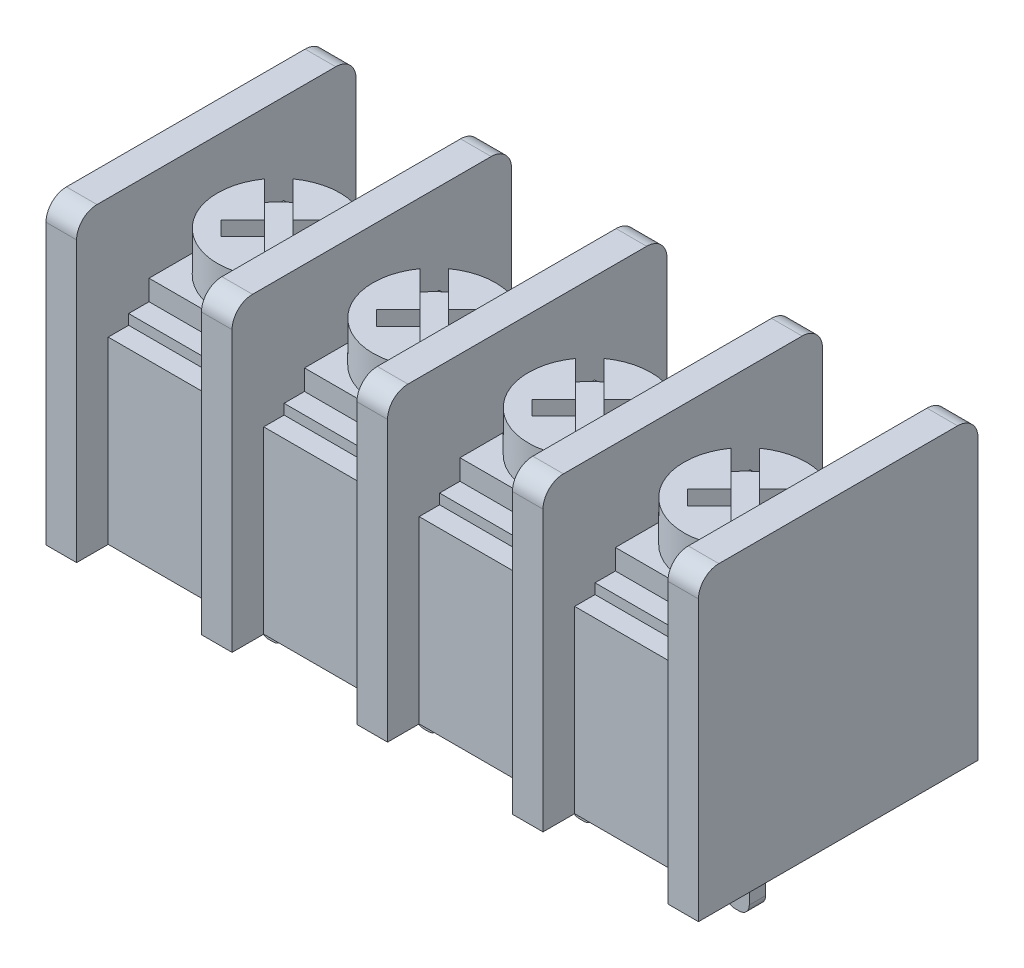
from build123d import *

# Parameters (mm, degrees)
CROQUIS1_W                  = 1.5
CROQUIS1_H                  = 13.7
SALIENTE_EXTRUIR1_DEPTH     = 14.7
REDONDEO1_R                 = 1
MATRIZL1_COUNT              = 3
MATRIZL1_PITCH              = 7.62
MATRIZL1_2_COUNT            = 3
MATRIZL1_2_PITCH            = 7.62
CROQUIS2_W                  = 31.98
CROQUIS2_H                  = 10.6
SALIENTE_EXTRUIR2_DEPTH     = 8.8
CROQUIS4_W                  = 1.2
CROQUIS4_H                  = 0.8
SALIENTE_EXTRUIR5_DEPTH     = 5
REDONDEO4_R                 = 0.5
MATRIZL2_COUNT              = 2
MATRIZL2_PITCH              = 7.62
REDONDEO4_OF_MATRIZL2_R     = 0.5
MATRIZL2_COL_COUNT          = 3
MATRIZL2_COL_PITCH          = 7.62
REDONDEO4_OF_MATRIZL2_COL_R = 0.5
CROQUIS5_W                  = 6.12
CROQUIS5_H                  = 8.6
SALIENTE_EXTRUIR6_DEPTH     = 0.5
CROQUIS6_W                  = 6.12
CROQUIS6_H                  = 6.6
SALIENTE_EXTRUIR7_DEPTH     = 1
CROQUIS7_R                  = 3
SALIENTE_EXTRUIR14_DEPTH    = 2
CORTAR_EXTRUIR2_START       = -1
CORTAR_EXTRUIR2_DEPTH       = 1
MATRIZL3_COUNT              = 2
MATRIZL3_PITCH              = 7.62
MATRIZL3_COL_COUNT          = 3
MATRIZL3_COL_PITCH          = 7.62


with BuildPart() as part:
    # Croquis1 → Saliente-Extruir1 (new body)
    with BuildSketch(Plane(origin=(0, 0, 0), x_dir=(1, 0, 0), z_dir=(0, 1, 0))):
        Rectangle(CROQUIS1_W, CROQUIS1_H)
    extrude(amount=SALIENTE_EXTRUIR1_DEPTH)

    # Redondeo1
    redondeo1_edges = [part.edges().sort_by_distance(p)[0] for p in [
        (0, 14.7, 6.85),
        (0, 14.7, -6.85),
    ]]
    fillet(redondeo1_edges, radius=REDONDEO1_R)


with BuildPart() as matrizl1_1:
    # MatrizL1: pattern copy
    add(part.part.moved(Location(Vector(1, 0, 0) * (1 * MATRIZL1_PITCH))))


with BuildPart() as matrizl1_2:
    # MatrizL1: pattern copy
    add(part.part.moved(Location(Vector(1, 0, 0) * (2 * MATRIZL1_PITCH))))


with BuildPart() as matrizl1_2_1:
    # MatrizL1 2: pattern copy
    add(part.part.moved(Location(Vector(-1, 0, 0) * (1 * MATRIZL1_2_PITCH))))


with BuildPart() as matrizl1_2_2:
    # MatrizL1 2: pattern copy
    add(part.part.moved(Location(Vector(-1, 0, 0) * (2 * MATRIZL1_2_PITCH))))


with BuildPart() as part_1:
    add(part.part)

    add(matrizl1_1.part)  # Saliente-Extruir2 merges MatrizL1_1

    add(matrizl1_2.part)  # Saliente-Extruir2 merges MatrizL1_2

    add(matrizl1_2_1.part)  # Saliente-Extruir2 merges MatrizL1 2_1

    add(matrizl1_2_2.part)  # Saliente-Extruir2 merges MatrizL1 2_2
    # Croquis2 → Saliente-Extruir2 (add)
    with BuildSketch(Plane(origin=(0, 0, 0), x_dir=(1, 0, 0), z_dir=(0, 1, 0))):
        Rectangle(CROQUIS2_W, CROQUIS2_H)
    extrude(amount=SALIENTE_EXTRUIR2_DEPTH)

    # Croquis4 → Saliente-Extruir5 (add)
    with BuildSketch(Plane.XZ):
        with Locations((-3.81, 0)):
            Rectangle(CROQUIS4_W, CROQUIS4_H)
    saliente_extruir5 = extrude(amount=SALIENTE_EXTRUIR5_DEPTH)

    # Redondeo4
    redondeo4_edges = [part_1.edges().sort_by_distance(p)[0] for p in [
        (-3.21, -5, 0),
        (-4.41, -5, 0),
    ]]
    fillet(redondeo4_edges, radius=REDONDEO4_R)

    # MatrizL2: Saliente-Extruir5 ×2
    with Locations(*[(-i * MATRIZL2_PITCH, 0, 0) for i in range(1, MATRIZL2_COUNT)]):
        add(saliente_extruir5)

    # Redondeo4 of MatrizL2
    redondeo4_of_matrizl2_edges = [part_1.edges().sort_by_distance(p)[0] for p in [
        (-10.83, -5, 0),
        (-12.03, -5, 0),
    ]]
    fillet(redondeo4_of_matrizl2_edges, radius=REDONDEO4_OF_MATRIZL2_R)

    # MatrizL2 col: Saliente-Extruir5 ×3
    with Locations(*[(i * MATRIZL2_COL_PITCH, 0, 0) for i in range(1, MATRIZL2_COL_COUNT)]):
        add(saliente_extruir5)

    # Redondeo4 of MatrizL2 col
    redondeo4_of_matrizl2_col_edges = [part_1.edges().sort_by_distance(p)[0] for p in [
        (4.41, -5, 0),
        (3.21, -5, 0),
        (12.03, -5, 0),
        (10.83, -5, 0),
    ]]
    fillet(redondeo4_of_matrizl2_col_edges, radius=REDONDEO4_OF_MATRIZL2_COL_R)

    # Croquis5 → Saliente-Extruir6 (add)
    with BuildSketch(Plane(origin=(0, 8.8, 0), x_dir=(1, 0, 0), z_dir=(0, 1, 0))):
        with Locations((-3.81, 0)):
            Rectangle(CROQUIS5_W, CROQUIS5_H)
    saliente_extruir6 = extrude(amount=SALIENTE_EXTRUIR6_DEPTH)

    # Croquis6 → Saliente-Extruir7 (add)
    with BuildSketch(Plane(origin=(0, 9.3, 0), x_dir=(1, 0, 0), z_dir=(0, 1, 0))):
        with Locations((-3.81, 0)):
            Rectangle(CROQUIS6_W, CROQUIS6_H)
    saliente_extruir7 = extrude(amount=SALIENTE_EXTRUIR7_DEPTH)

    # Croquis7 → Saliente-Extruir14 (add)
    with BuildSketch(Plane(origin=(0, 10.3, 0), x_dir=(1, 0, 0), z_dir=(0, 1, 0))):
        with Locations(Location((-3.81, 0, 0), (0, 0, 90))):
            Circle(CROQUIS7_R)
    saliente_extruir14 = extrude(amount=SALIENTE_EXTRUIR14_DEPTH)

    # Croquis13 → Cortar-Extruir2 (cut)
    with BuildSketch(Plane(origin=(0, 12.3, 0), x_dir=(1, 0, 0), z_dir=(0, 1, 0)).offset(CORTAR_EXTRUIR2_START)):
        with BuildLine():
            ThreePointArc((-5.548096676, 2.445203457), (-5.931320344, 2.121320344), (-6.255203457, 1.738096676))
            Line((-6.255203457, 1.738096676), (-4.517106781, 0))
            Line((-4.517106781, 0), (-3.81, 0.707106781))
            Line((-3.81, 0.707106781), (-5.548096676, 2.445203457))
        make_face()
        Polygon((-3.81, 0.707106781), (-3.102893219, 0), (-2.042233047, 1.060660172), (-2.749339828, 1.767766953), align=None)
        Polygon((-4.870660172, -1.767766953), (-3.81, -0.707106781), (-4.517106781, 0), (-5.577766953, -1.060660172), align=None)
        Polygon((-4.517106781, 0), (-3.81, -0.707106781), (-3.102893219, 0), (-3.81, 0.707106781), align=None)
        with BuildLine():
            Line((-3.81, -0.707106781), (-2.071903324, -2.445203457))
            ThreePointArc((-2.071903324, -2.445203457), (-1.688679656, -2.121320344), (-1.364796543, -1.738096676))
            Line((-1.364796543, -1.738096676), (-3.102893219, 0))
            Line((-3.102893219, 0), (-3.81, -0.707106781))
        make_face()
    cortar_extruir2 = extrude(amount=CORTAR_EXTRUIR2_DEPTH, mode=Mode.SUBTRACT)

    # MatrizL3: Saliente-Extruir6, Saliente-Extruir7, Saliente-Extruir14, Cortar-Extruir2 ×2
    with Locations(*[(-i * MATRIZL3_PITCH, 0, 0) for i in range(1, MATRIZL3_COUNT)]):
        add(saliente_extruir6)
        add(saliente_extruir7)
        add(saliente_extruir14)
        add(cortar_extruir2, mode=Mode.SUBTRACT)

    # MatrizL3 col: Saliente-Extruir6, Saliente-Extruir7, Saliente-Extruir14, Cortar-Extruir2 ×3
    with Locations(*[(i * MATRIZL3_COL_PITCH, 0, 0) for i in range(1, MATRIZL3_COL_COUNT)]):
        add(saliente_extruir6)
        add(saliente_extruir7)
        add(saliente_extruir14)
        add(cortar_extruir2, mode=Mode.SUBTRACT)


solid = part_1.part
